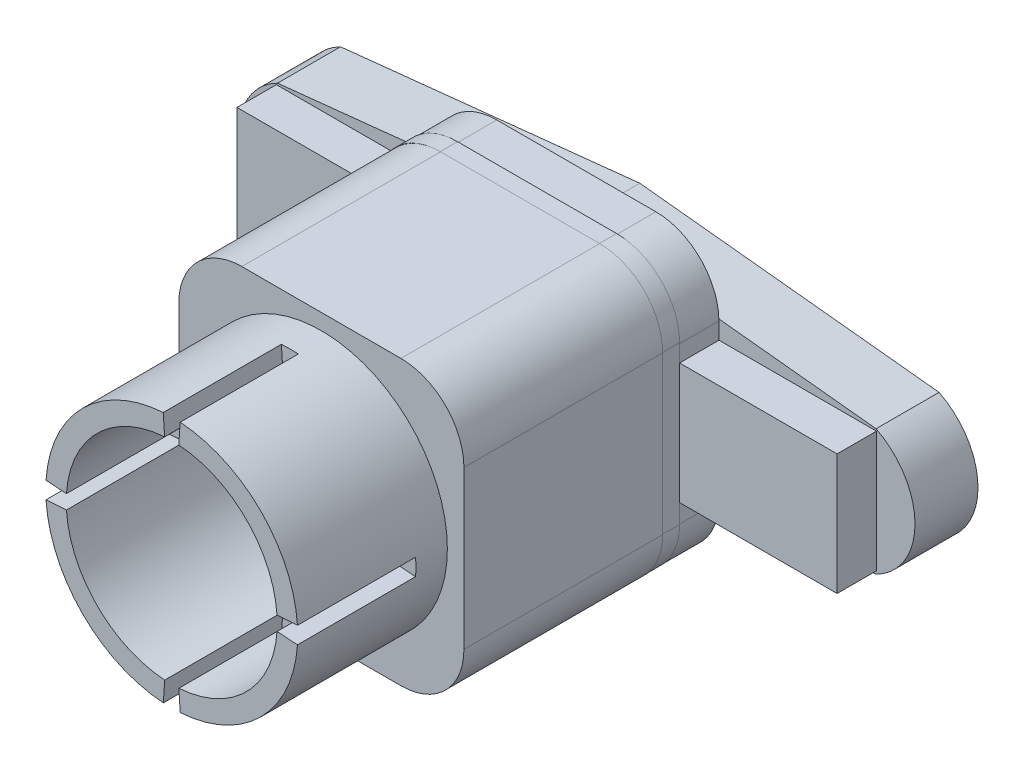
from build123d import *

# Parameters (mm, degrees)
BOSS_EXTRUDE1_DEPTH = 2
BOSS_EXTRUDE2_DEPTH = 11.02
BOSS_EXTRUDE3_DEPTH = 1.6
SKETCH4_R           = 8
BOSS_EXTRUDE4_DEPTH = 9.5
SKETCH5_R           = 6.65
CUT_EXTRUDE1_DEPTH  = 20
BOSS_EXTRUDE5_DEPTH = 1.095
SKETCH13_R          = 6.7
CUT_EXTRUDE3_DEPTH  = 30
CUT_EXTRUDE4_DEPTH  = 7.5
CIRPATTERN2_COUNT   = 4
BOSS_EXTRUDE6_DEPTH = 2.5
BOSS_EXTRUDE7_DEPTH = 4


with BuildPart() as part:
    # Sketch1 → Boss-Extrude1 (new body)
    with BuildSketch(Plane.XY):
        with BuildLine():
            Line((-5.05, 9.000108401), (5.05, 9.000108401))
            ThreePointArc((5.05, 9.000108401), (7.878427125, 7.828535526), (9.05, 5.000108401))
            Line((9.05, 5.000108401), (9.05, -5.000108401))
            ThreePointArc((9.05, -5.000108401), (7.878427125, -7.828535526), (5.05, -9.000108401))
            Line((5.05, -9.000108401), (-5.05, -9.000108401))
            ThreePointArc((-5.05, -9.000108401), (-7.878427125, -7.828535526), (-9.05, -5.000108401))
            Line((-9.05, -5.000108401), (-9.05, 5.000108401))
            ThreePointArc((-9.05, 5.000108401), (-7.878427125, 7.828535526), (-5.05, 9.000108401))
        make_face()
    extrude(amount=BOSS_EXTRUDE1_DEPTH)

    # Sketch2 → Boss-Extrude2 (add)
    with BuildSketch(Plane.XY):
        with BuildLine():
            Line((-5.05, 9.000108401), (5.05, 9.000108401))
            ThreePointArc((5.05, 9.000108401), (7.878427125, 7.828535526), (9.05, 5.000108401))
            Line((9.05, 5.000108401), (9.05, -5.000108401))
            ThreePointArc((9.05, -5.000108401), (7.878427125, -7.828535526), (5.05, -9.000108401))
            Line((5.05, -9.000108401), (-5.05, -9.000108401))
            ThreePointArc((-5.05, -9.000108401), (-7.878427125, -7.828535526), (-9.05, -5.000108401))
            Line((-9.05, -5.000108401), (-9.05, 5.000108401))
            ThreePointArc((-9.05, 5.000108401), (-7.878427125, 7.828535526), (-5.05, 9.000108401))
        make_face()
    extrude(amount=BOSS_EXTRUDE2_DEPTH)

    # Sketch3 → Boss-Extrude3 (add)
    with BuildSketch(Plane.XY.offset(11.02)):
        with BuildLine():
            Line((-5.05, 9.000108401), (5.05, 9.000108401))
            ThreePointArc((5.05, 9.000108401), (7.878427125, 7.828535526), (9.05, 5.000108401))
            Line((9.05, 5.000108401), (9.05, -5.000108401))
            ThreePointArc((9.05, -5.000108401), (7.878427125, -7.828535526), (5.05, -9.000108401))
            Line((5.05, -9.000108401), (-5.05, -9.000108401))
            ThreePointArc((-5.05, -9.000108401), (-7.878427125, -7.828535526), (-9.05, -5.000108401))
            Line((-9.05, -5.000108401), (-9.05, 5.000108401))
            ThreePointArc((-9.05, 5.000108401), (-7.878427125, 7.828535526), (-5.05, 9.000108401))
        make_face()
    extrude(amount=BOSS_EXTRUDE3_DEPTH)

    # Sketch4 → Boss-Extrude4 (add)
    with BuildSketch(Plane.XY.offset(12.62)):
        Circle(SKETCH4_R)
    extrude(amount=BOSS_EXTRUDE4_DEPTH)

    # Sketch5 → Cut-Extrude1 (cut)
    with BuildSketch(Plane.XY.offset(12.62)):
        Circle(SKETCH5_R)
    extrude(amount=CUT_EXTRUDE1_DEPTH, mode=Mode.SUBTRACT)

    # Sketch12 → Boss-Extrude5 (add)
    with BuildSketch(Plane(origin=(0, 0, 0), x_dir=(-1, 0, 0), z_dir=(0, 0, -1))):
        with BuildLine():
            Line((-5.027404416, 8.997340309), (5.072595584, 8.997340309))
            ThreePointArc((5.072595584, 8.997340309), (7.901022709, 7.825767433), (9.072595584, 4.997340309))
            Line((9.072595584, 4.997340309), (9.072595584, -5.002876493))
            ThreePointArc((9.072595584, -5.002876493), (7.901022709, -7.831303618), (5.072595584, -9.002876493))
            Line((5.072595584, -9.002876493), (-5.027404416, -9.002876493))
            ThreePointArc((-5.027404416, -9.002876493), (-7.85583154, -7.831303618), (-9.027404416, -5.002876493))
            Line((-9.027404416, -5.002876493), (-9.027404416, 4.997340309))
            ThreePointArc((-9.027404416, 4.997340309), (-7.85583154, 7.825767433), (-5.027404416, 8.997340309))
        make_face()
    extrude(amount=BOSS_EXTRUDE5_DEPTH)

    # Sketch13 → Cut-Extrude3 (cut, symmetric)
    with BuildSketch(Plane.XY):
        Circle(SKETCH13_R)
    extrude(amount=CUT_EXTRUDE3_DEPTH, both=True, mode=Mode.SUBTRACT)

    # Sketch15 → Cut-Extrude4 (cut)
    with BuildSketch(Plane.XY.offset(22.12)):
        Polygon((-0.552830798, 8.187091014), (-0.002830798, 0.003314653), (0.547169202, 8.187091014), (0.617169202, 9.000108401), (-0.626042329, 9.000108401), align=None)
    cut_extrude4 = extrude(amount=-CUT_EXTRUDE4_DEPTH, mode=Mode.SUBTRACT)

    # CirPattern2: Cut-Extrude4 ×4 about axis
    cirpattern2_axis = Axis((0, 0, 0), (0, 0, 1))
    for i in range(1, CIRPATTERN2_COUNT):
        add(cut_extrude4.rotate(cirpattern2_axis, i * 360 / CIRPATTERN2_COUNT), mode=Mode.SUBTRACT)


with BuildPart() as body_2:
    # Sketch16 → Boss-Extrude6 (new body)
    with BuildSketch(Plane(origin=(0, 0, -1.095), x_dir=(-1, 0, 0), z_dir=(0, 0, -1))):
        with BuildLine():
            Line((-5.0235757, 8.939451881), (5.076696464, 8.939451881))
            ThreePointArc((5.076696464, 8.939451881), (7.905123589, 7.767879006), (9.076696464, 4.939451881))
            Line((9.076696464, 4.939451881), (9.072595584, 3.880790969))
            Line((9.072595584, 3.880790969), (19.072595584, 3.880790969))
            Line((19.072595584, 3.880790969), (19.072595584, -4.536431038))
            Line((19.072595584, -4.536431038), (9.072595584, -4.536431038))
            Line((9.072595584, -4.536431038), (9.076550984, -4.98570964))
            ThreePointArc((9.076550984, -4.98570964), (7.907149741, -7.818099531), (5.076555683, -8.991841001))
            Line((5.076555683, -8.991841001), (-5.023434919, -8.991841001))
            ThreePointArc((-5.023434919, -8.991841001), (-7.854028977, -7.818099531), (-9.02343022, -4.98570964))
            Line((-9.02343022, -4.98570964), (-9.027404416, -3.796455477))
            Line((-9.027404416, -3.796455477), (-19.027404416, -3.796455477))
            Line((-19.027404416, -3.796455477), (-19.027404416, 3.880790969))
            Line((-19.027404416, 3.880790969), (-9.027404416, 3.880790969))
            Line((-9.027404416, 3.880790969), (-9.0235757, 4.939451881))
            ThreePointArc((-9.0235757, 4.939451881), (-7.852002825, 7.767879006), (-5.0235757, 8.939451881))
        make_face()
    extrude(amount=BOSS_EXTRUDE6_DEPTH)

    # Sketch17 → Boss-Extrude7 (add)
    with BuildSketch(Plane(origin=(0, 0, -3.595), x_dir=(-1, 0, 0), z_dir=(0, 0, -1))):
        with BuildLine():
            Line((0, 6), (-19, 4))
            ThreePointArc((-19, 4), (-21.472135955, 0), (-19, -4))
            Line((-19, -4), (0, -6))
            Line((0, -6), (19, -4))
            ThreePointArc((19, -4), (21.472135955, 0), (19, 4))
            Line((19, 4), (0, 6))
        make_face()
        with BuildLine():
            Line((0, 3.7), (-16, 2.2))
            ThreePointArc((-16, 2.2), (-17.416609195, 0), (-16, -2.2))
            Line((-16, -2.2), (0, -3.7))
            Line((0, -3.7), (16, -2.197468551))
            ThreePointArc((16, -2.197468551), (17.415456978, 0.001265724), (16, 2.2))
            Line((16, 2.2), (0, 3.7))
        make_face(mode=Mode.SUBTRACT)
    extrude(amount=BOSS_EXTRUDE7_DEPTH)


solid = Compound([part.part, body_2.part])
